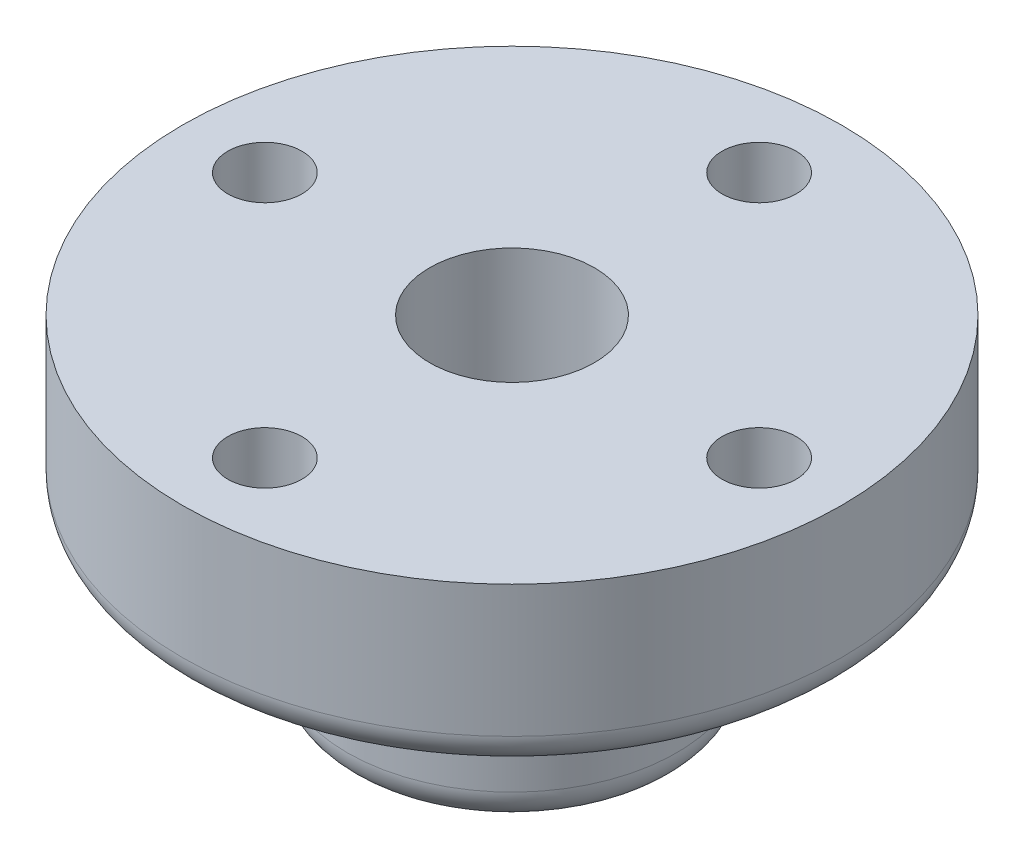
from build123d import *

# Parameters (mm, degrees)
SKETCH1_R           = 254
BOSS_EXTRUDE1_DEPTH = 254
SKETCH2_R           = 508
BOSS_EXTRUDE2_DEPTH = 254
SKETCH3_R           = 127
CUT_EXTRUDE1_DEPTH  = 880.881810245
SKETCH4_R           = 57.15
CUT_EXTRUDE2_DEPTH  = 763
FILLET1_R           = 50.8


with BuildPart() as part:
    # Sketch1 → Boss-Extrude1 (new body)
    with BuildSketch(Plane(origin=(0, 0, 0), x_dir=(1, 0, 0), z_dir=(0, 1, 0))):
        with Locations(Location((0, 0, 0), (0, 0, 270))):
            Circle(SKETCH1_R)
    extrude(amount=BOSS_EXTRUDE1_DEPTH)

    # Sketch2 → Boss-Extrude2 (add)
    with BuildSketch(Plane(origin=(0, 254, 0), x_dir=(1, 0, 0), z_dir=(0, 1, 0))):
        with Locations(Location((0, 0, 0), (0, 0, 270))):
            Circle(SKETCH2_R)
    extrude(amount=BOSS_EXTRUDE2_DEPTH)

    # Sketch3 → Cut-Extrude1 (cut, through all)
    with BuildSketch(Plane.XZ):
        with Locations(Location((0, 0, 0), (0, 0, 270))):
            Circle(SKETCH3_R)
    extrude(amount=-CUT_EXTRUDE1_DEPTH, mode=Mode.SUBTRACT)

    # Sketch4 → Cut-Extrude2 (cut, through all)
    with BuildSketch(Plane.XZ.offset(-254)):
        with Locations(Location((0, -381, 0), (0, 0, 270))):
            Circle(SKETCH4_R)
        with Locations(Location((381, 0, 0), (0, 0, 270))):
            Circle(SKETCH4_R)
        with Locations(Location((0, 381, 0), (0, 0, 270))):
            Circle(SKETCH4_R)
        with Locations(Location((-381, 0, 0), (0, 0, 270))):
            Circle(SKETCH4_R)
    extrude(amount=-CUT_EXTRUDE2_DEPTH, mode=Mode.SUBTRACT)

    # Fillet1
    fillet1_edges = [part.edges().sort_by_distance(p)[0] for p in [
        (0, 0, -254),
        (0, 254, -254),
        (0, 254, -508),
    ]]
    fillet(fillet1_edges, radius=FILLET1_R)


solid = part.part
